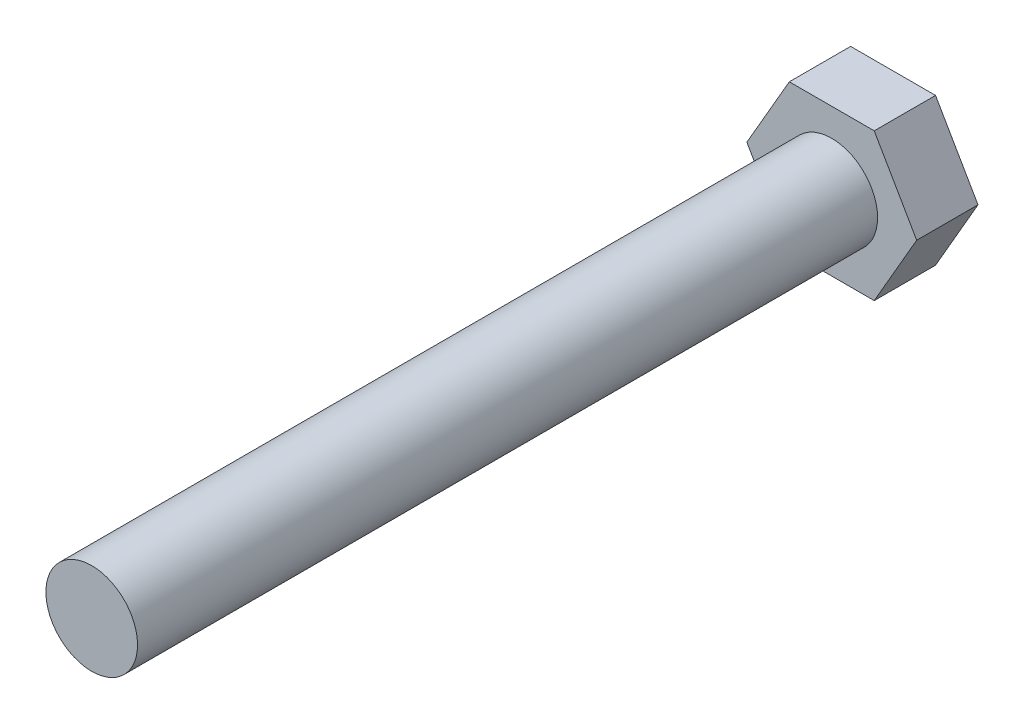
from build123d import *

# Parameters (mm, degrees)
SKETCH1_R           = 3.9
BOSS_EXTRUDE1_DEPTH = 63
BOSS_EXTRUDE2_DEPTH = 5.22


with BuildPart() as part:
    # Sketch1 → Boss-Extrude1 (new body)
    with BuildSketch(Plane.XY):
        Circle(SKETCH1_R)
    extrude(amount=BOSS_EXTRUDE1_DEPTH)

    # Sketch2 → Boss-Extrude2 (add)
    with BuildSketch(Plane(origin=(0, 0, 0), x_dir=(-1, 0, 0), z_dir=(0, 0, -1))):
        Polygon((3.614212685, -6.26), (7.22842537, 0), (3.614212685, 6.26), (-3.614212685, 6.26), (-7.22842537, 0), (-3.614212685, -6.26), align=None)
    extrude(amount=BOSS_EXTRUDE2_DEPTH)


solid = part.part
